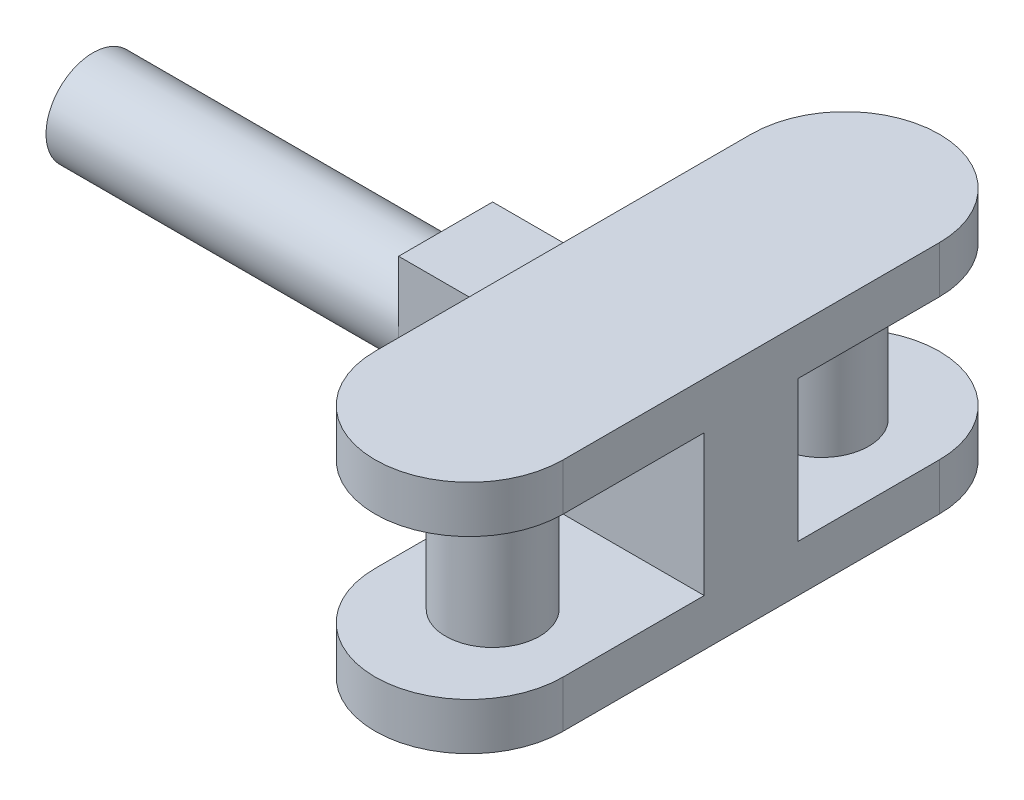
from build123d import *

# Parameters (mm, degrees)
ESQUISSE1_W             = 8
ESQUISSE1_H             = 24
BOSS_EXTRU_1_DEPTH      = 10
ESQUISSE2_W             = 10
ESQUISSE2_H             = 6
ENL_V_MAT_EXTRU_1_DEPTH = 10
ESQUISSE3_R             = 2
BOSS_EXTRU_2_DEPTH      = 6
CONG_1_RADIUS           = 4
CONG_1_LENGTH           = 2
CONG_2_RADIUS           = 4
CONG_2_LENGTH           = 2
CONG_3_RADIUS           = 4
CONG_3_LENGTH           = 2
CONG_4_RADIUS           = 4
CONG_4_LENGTH           = 2
ESQUISSE4_R             = 2
BOSS_EXTRU_3_DEPTH      = 20
ESQUISSE5_W             = 4
ESQUISSE5_H             = 6
BOSS_EXTRU_4_DEPTH      = 5


with BuildPart() as part:
    # Esquisse1 → Boss.-Extru.1 (new body)
    with BuildSketch(Plane(origin=(0, 0, 0), x_dir=(1, 0, 0), z_dir=(0, 1, 0))):
        with Locations((4, 12)):
            Rectangle(ESQUISSE1_W, ESQUISSE1_H)
    extrude(amount=BOSS_EXTRU_1_DEPTH)

    # Esquisse2 → Enlèv. mat.-Extru.1 (cut)
    with BuildSketch(Plane(origin=(8, 0, 0), x_dir=(0, 0, -1), z_dir=(1, 0, 0))):
        with Locations((5, 5)):
            Rectangle(ESQUISSE2_W, ESQUISSE2_H)
        with Locations((19, 5)):
            Rectangle(ESQUISSE2_W, ESQUISSE2_H)
    extrude(amount=-ENL_V_MAT_EXTRU_1_DEPTH, mode=Mode.SUBTRACT)

    # Esquisse3 → Boss.-Extru.2 (add)
    with BuildSketch(Plane(origin=(0, 2, 0), x_dir=(1, 0, 0), z_dir=(0, 1, 0))):
        with Locations(Location((4, 5, 0), (0, 0, 90))):
            Circle(ESQUISSE3_R)
        with Locations(Location((4, 19, 0), (0, 0, 90))):
            Circle(ESQUISSE3_R)
    extrude(amount=BOSS_EXTRU_2_DEPTH)

    # Congé1: full round fillet: the end face becomes a half cylinder, R = half its width
    cong_1_face = Plane((4, 1, -24), x_dir=(0, 1, 0), z_dir=(0, 0, -1))  # on the end face: x along it, z out of the body
    cong_1_slab = cong_1_face.offset(-CONG_1_RADIUS / 2) * Box(CONG_1_LENGTH, 2 * CONG_1_RADIUS, CONG_1_RADIUS, mode=Mode.PRIVATE)  # the body's end, R deep
    cong_1_round = Plane((4, 1, -20), x_dir=(0, 0, -1), z_dir=(0, 1, 0)) * Cylinder(CONG_1_RADIUS, CONG_1_LENGTH, mode=Mode.PRIVATE)  # its axis R under the face
    add(cong_1_slab - cong_1_round, mode=Mode.SUBTRACT)

    # Congé2: full round fillet: the end face becomes a half cylinder, R = half its width
    cong_2_face = Plane((4, 9, -24), x_dir=(0, 1, 0), z_dir=(0, 0, -1))  # on the end face: x along it, z out of the body
    cong_2_slab = cong_2_face.offset(-CONG_2_RADIUS / 2) * Box(CONG_2_LENGTH, 2 * CONG_2_RADIUS, CONG_2_RADIUS, mode=Mode.PRIVATE)  # the body's end, R deep
    cong_2_round = Plane((4, 9, -20), x_dir=(0, 0, -1), z_dir=(0, 1, 0)) * Cylinder(CONG_2_RADIUS, CONG_2_LENGTH, mode=Mode.PRIVATE)  # its axis R under the face
    add(cong_2_slab - cong_2_round, mode=Mode.SUBTRACT)

    # Congé3: full round fillet: the end face becomes a half cylinder, R = half its width
    cong_3_face = Plane((4, 9, 0), x_dir=(0, 1, 0), z_dir=(0, 0, 1))  # on the end face: x along it, z out of the body
    cong_3_slab = cong_3_face.offset(-CONG_3_RADIUS / 2) * Box(CONG_3_LENGTH, 2 * CONG_3_RADIUS, CONG_3_RADIUS, mode=Mode.PRIVATE)  # the body's end, R deep
    cong_3_round = Plane((4, 9, -4), x_dir=(0, 0, 1), z_dir=(0, 1, 0)) * Cylinder(CONG_3_RADIUS, CONG_3_LENGTH, mode=Mode.PRIVATE)  # its axis R under the face
    add(cong_3_slab - cong_3_round, mode=Mode.SUBTRACT)

    # Congé4: full round fillet: the end face becomes a half cylinder, R = half its width
    cong_4_face = Plane((4, 1, 0), x_dir=(0, 1, 0), z_dir=(0, 0, 1))  # on the end face: x along it, z out of the body
    cong_4_slab = cong_4_face.offset(-CONG_4_RADIUS / 2) * Box(CONG_4_LENGTH, 2 * CONG_4_RADIUS, CONG_4_RADIUS, mode=Mode.PRIVATE)  # the body's end, R deep
    cong_4_round = Plane((4, 1, -4), x_dir=(0, 0, 1), z_dir=(0, 1, 0)) * Cylinder(CONG_4_RADIUS, CONG_4_LENGTH, mode=Mode.PRIVATE)  # its axis R under the face
    add(cong_4_slab - cong_4_round, mode=Mode.SUBTRACT)

    # Esquisse4 → Boss.-Extru.3 (add)
    with BuildSketch(Plane.ZY):
        with Locations((-12, 5)):
            Circle(ESQUISSE4_R)
    extrude(amount=BOSS_EXTRU_3_DEPTH)

    # Esquisse5 → Boss.-Extru.4 (add)
    with BuildSketch(Plane.ZY):
        with Locations((-12, 5)):
            Rectangle(ESQUISSE5_W, ESQUISSE5_H)
    extrude(amount=BOSS_EXTRU_4_DEPTH)


solid = part.part
